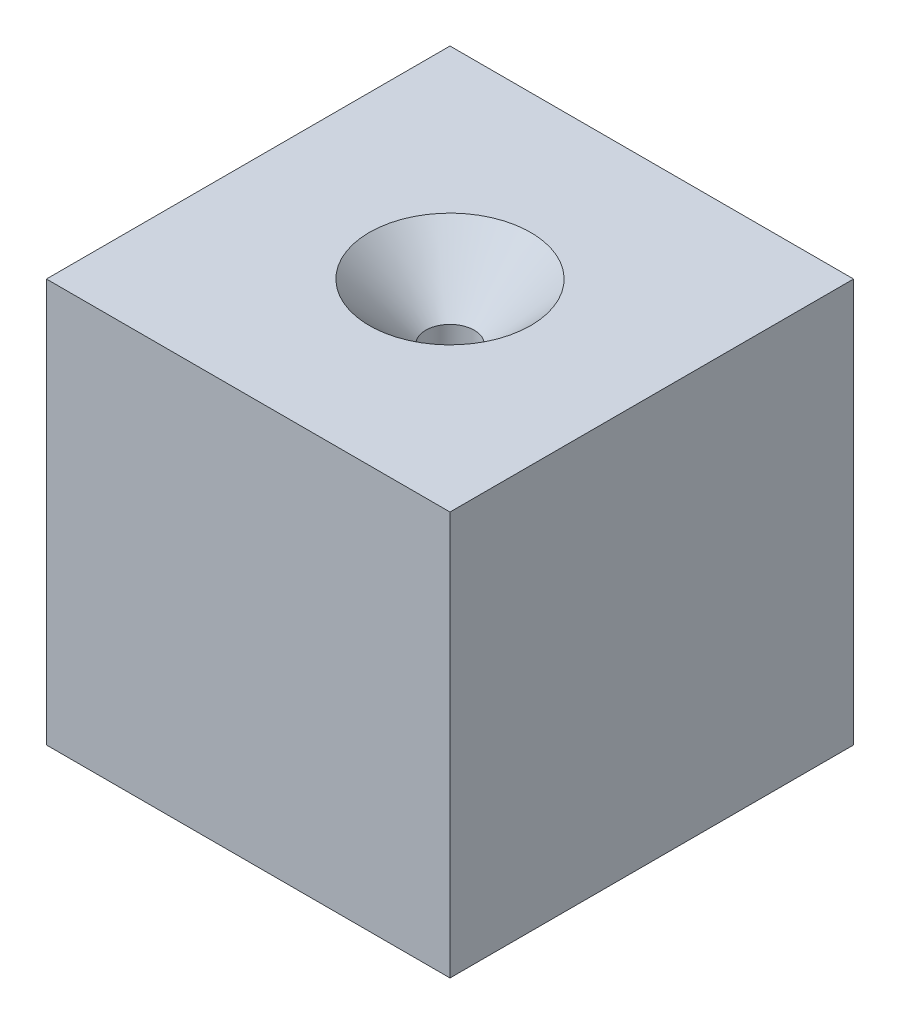
from build123d import *

# Parameters (mm, degrees)
SKETCH_1_W      = 50
SKETCH_1_H      = 50
EXTRUDE_1_DEPTH = 50


with BuildPart() as part:
    # 草图1 → 凸台-拉伸1 (new body)
    with BuildSketch(Plane.XY):
        with Locations((-11.096434238, -4.411764706)):
            Rectangle(SKETCH_1_W, SKETCH_1_H)
    extrude(amount=EXTRUDE_1_DEPTH)

    # 草图3 → 切除-旋转1 (revolve, cut)
    with BuildSketch(Plane(origin=(-11.096434238, 0, 0), x_dir=(0, 0, -1), z_dir=(1, 0, 0)), mode=Mode.PRIVATE) as cut_revolve_1_sk:
        Polygon((-25, 20.588235294), (-35, 20.588235294), (-28, 13.598319189), (-28, -29.411764706), (-25, -29.411764706), align=None)
    revolve(cut_revolve_1_sk.sketch.rotate(Axis((-11.096434238, 20.588235294, 25), (0, -1, 0)), 90), axis=Axis((-11.096434238, 20.588235294, 25), (0, -1, 0)), mode=Mode.SUBTRACT)


solid = part.part
